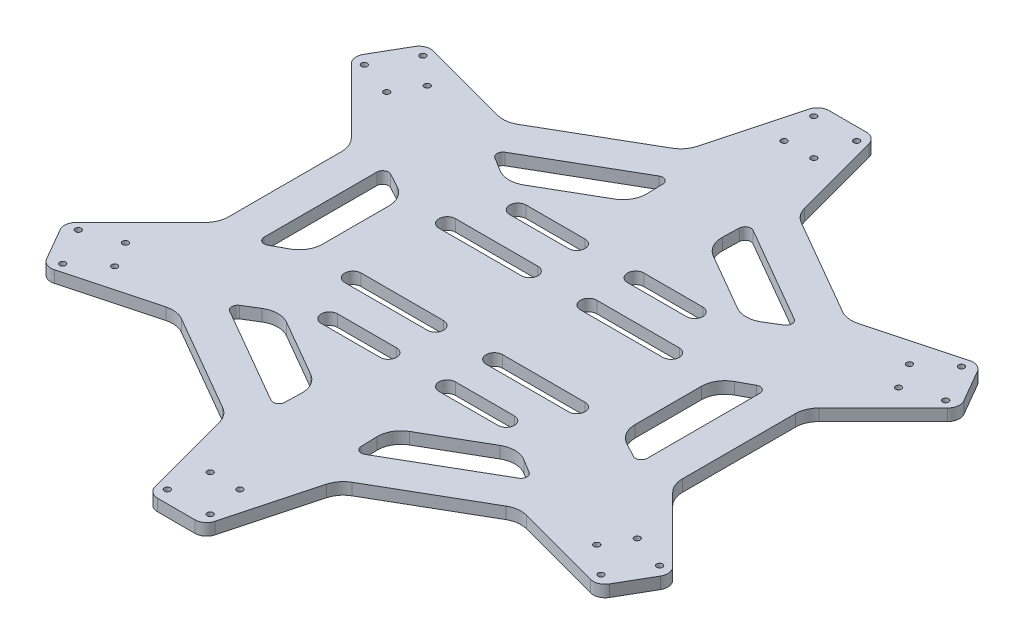
from build123d import *

# Parameters (mm, degrees)
BOSS_EXTRUDE1_DEPTH      = 5
SKETCH3_R                = 1.25
CUT_EXTRUDE1_DEPTH       = 218.729763698
FILLET3_R                = 2.5
FILLET4_R                = 10
CIRPATTERN4_COUNT        = 6
FILLET3_OF_CIRPATTERN4_R = 2.5
FILLET4_OF_CIRPATTERN4_R = 10
FILLET1_R                = 10
FILLET2_R                = 5
CUT_EXTRUDE2_DEPTH       = 192.635738259


with BuildPart() as part:
    # Sketch1 → Boss-Extrude1 (new body)
    with BuildSketch(Plane(origin=(0, 0, 0), x_dir=(1, 0, 0), z_dir=(0, 1, 0))):
        Polygon((-82.27241336, 142.5), (-164.544826719, 0), (-82.27241336, -142.5), (82.27241336, -142.5), (164.544826719, 0), (82.27241336, 142.5), align=None)
    extrude(amount=BOSS_EXTRUDE1_DEPTH)

    # Sketch3 → Cut-Extrude1 (cut, through all)
    with BuildSketch(Plane(origin=(0, 5, 0), x_dir=(1, 0, 0), z_dir=(0, 1, 0))):
        with Locations((9.1, 137.2)):
            Circle(SKETCH3_R)
        with Locations((-9.1, 137.2)):
            Circle(SKETCH3_R)
        with Locations((-6.3, 121.8)):
            Circle(SKETCH3_R)
        with Locations((6.3, 121.8)):
            Circle(SKETCH3_R)
        Polygon((11.75, 142.5), (23.819395421, 97.456403074), (72.490023113, 69.356403074), (117.533620039, 81.425798494), (82.27241336, 142.5), align=None)
        Polygon((16.319395421, 84.466022017), (64.990023113, 56.366022017), (50.475217343, 47.42564096), (15.834201191, 67.42564096), align=None)
    cut_extrude1 = extrude(amount=-CUT_EXTRUDE1_DEPTH, mode=Mode.SUBTRACT)

    # Fillet3
    fillet3_edges = [part.edges().sort_by_distance(p)[0] for p in [
        (64.990023113, 2.5, -56.366022017),
        (16.319395421, 2.5, -84.466022017),
    ]]
    fillet(fillet3_edges, radius=FILLET3_R)

    # Fillet4
    fillet4_edges = [part.edges().sort_by_distance(p)[0] for p in [
        (50.475217343, 2.5, -47.42564096),
        (15.834201191, 2.5, -67.42564096),
    ]]
    fillet(fillet4_edges, radius=FILLET4_R)

    # CirPattern4: Cut-Extrude1 ×6 about axis
    cirpattern4_axis = Axis((0, 0, 0), (0, 1, 0))
    for i in range(1, CIRPATTERN4_COUNT):
        add(cut_extrude1.rotate(cirpattern4_axis, i * 360 / CIRPATTERN4_COUNT), mode=Mode.SUBTRACT)

    # Fillet3 of CirPattern4
    fillet3_of_cirpattern4_edges = [part.edges().sort_by_distance(p)[0] for p in [
        (-16.319395421, 2.5, -84.466022017),
        (-64.990023113, 2.5, -56.366022017),
        (-81.309418534, 2.5, -28.1),
        (-81.309418534, 2.5, 28.1),
        (-64.990023113, 2.5, 56.366022017),
        (-16.319395421, 2.5, 84.466022017),
        (16.319395421, 2.5, 84.466022017),
        (64.990023113, 2.5, 56.366022017),
        (81.309418534, 2.5, 28.1),
        (81.309418534, 2.5, -28.1),
    ]]
    fillet(fillet3_of_cirpattern4_edges, radius=FILLET3_OF_CIRPATTERN4_R)

    # Fillet4 of CirPattern4
    fillet4_of_cirpattern4_edges = [part.edges().sort_by_distance(p)[0] for p in [
        (-15.834201191, 2.5, -67.42564096),
        (-50.475217343, 2.5, -47.42564096),
        (-66.309418534, 2.5, -20),
        (-66.309418534, 2.5, 20),
        (-50.475217343, 2.5, 47.42564096),
        (-15.834201191, 2.5, 67.42564096),
        (15.834201191, 2.5, 67.42564096),
        (50.475217343, 2.5, 47.42564096),
        (66.309418534, 2.5, 20),
        (66.309418534, 2.5, -20),
    ]]
    fillet(fillet4_of_cirpattern4_edges, radius=FILLET4_OF_CIRPATTERN4_R)

    # Fillet1
    fillet1_edges = [part.edges().sort_by_distance(p)[0] for p in [
        (72.490023113, 2.5, -69.356403074),
        (23.819395421, 2.5, -97.456403074),
        (96.309418534, 2.5, -28.1),
        (96.309418534, 2.5, 28.1),
        (72.490023113, 2.5, 69.356403074),
        (23.819395421, 2.5, 97.456403074),
        (-23.819395421, 2.5, 97.456403074),
        (-72.490023113, 2.5, 69.356403074),
        (-96.309418534, 2.5, 28.1),
        (-96.309418534, 2.5, -28.1),
        (-72.490023113, 2.5, -69.356403074),
        (-23.819395421, 2.5, -97.456403074),
    ]]
    fillet(fillet1_edges, radius=FILLET1_R)

    # Fillet2
    fillet2_edges = [part.edges().sort_by_distance(p)[0] for p in [
        (11.75, 2.5, -142.5),
        (117.533620039, 2.5, -81.425798494),
        (-117.533620039, 2.5, -81.425798494),
        (-11.75, 2.5, -142.5),
        (-129.283620039, 2.5, -61.074201506),
        (-129.283620039, 2.5, 61.074201506),
        (-117.533620039, 2.5, 81.425798494),
        (-11.75, 2.5, 142.5),
        (11.75, 2.5, 142.5),
        (117.533620039, 2.5, 81.425798494),
        (129.283620039, 2.5, 61.074201506),
        (129.283620039, 2.5, -61.074201506),
    ]]
    fillet(fillet2_edges, radius=FILLET2_R)

    # Sketch6 → Cut-Extrude2 (cut, through all)
    with BuildSketch(Plane(origin=(0, 5, 0), x_dir=(1, 0, 0), z_dir=(0, 1, 0))):
        with BuildLine():
            Line((12.5, 43.5), (37.5, 43.5))
            ThreePointArc((37.5, 43.5), (41, 40), (37.5, 36.5))
            Line((37.5, 36.5), (12.5, 36.5))
            ThreePointArc((12.5, 36.5), (9, 40), (12.5, 43.5))
        make_face()
        with BuildLine():
            Line((12.5, 23.5), (47.5, 23.5))
            ThreePointArc((47.5, 23.5), (51, 20), (47.5, 16.5))
            Line((47.5, 16.5), (12.5, 16.5))
            ThreePointArc((12.5, 16.5), (9, 20), (12.5, 23.5))
        make_face()
        with BuildLine():
            Line((-12.5, 23.5), (-47.5, 23.5))
            ThreePointArc((-47.5, 23.5), (-51, 20), (-47.5, 16.5))
            Line((-47.5, 16.5), (-12.5, 16.5))
            ThreePointArc((-12.5, 16.5), (-9, 20), (-12.5, 23.5))
        make_face()
        with BuildLine():
            Line((-12.5, 43.5), (-37.5, 43.5))
            ThreePointArc((-37.5, 43.5), (-41, 40), (-37.5, 36.5))
            Line((-37.5, 36.5), (-12.5, 36.5))
            ThreePointArc((-12.5, 36.5), (-9, 40), (-12.5, 43.5))
        make_face()
    cut_extrude2 = extrude(amount=-CUT_EXTRUDE2_DEPTH, mode=Mode.SUBTRACT)

    # Mirror1: Cut-Extrude2 across plane
    add(cut_extrude2.mirror(Plane.XY), mode=Mode.SUBTRACT)


solid = part.part
